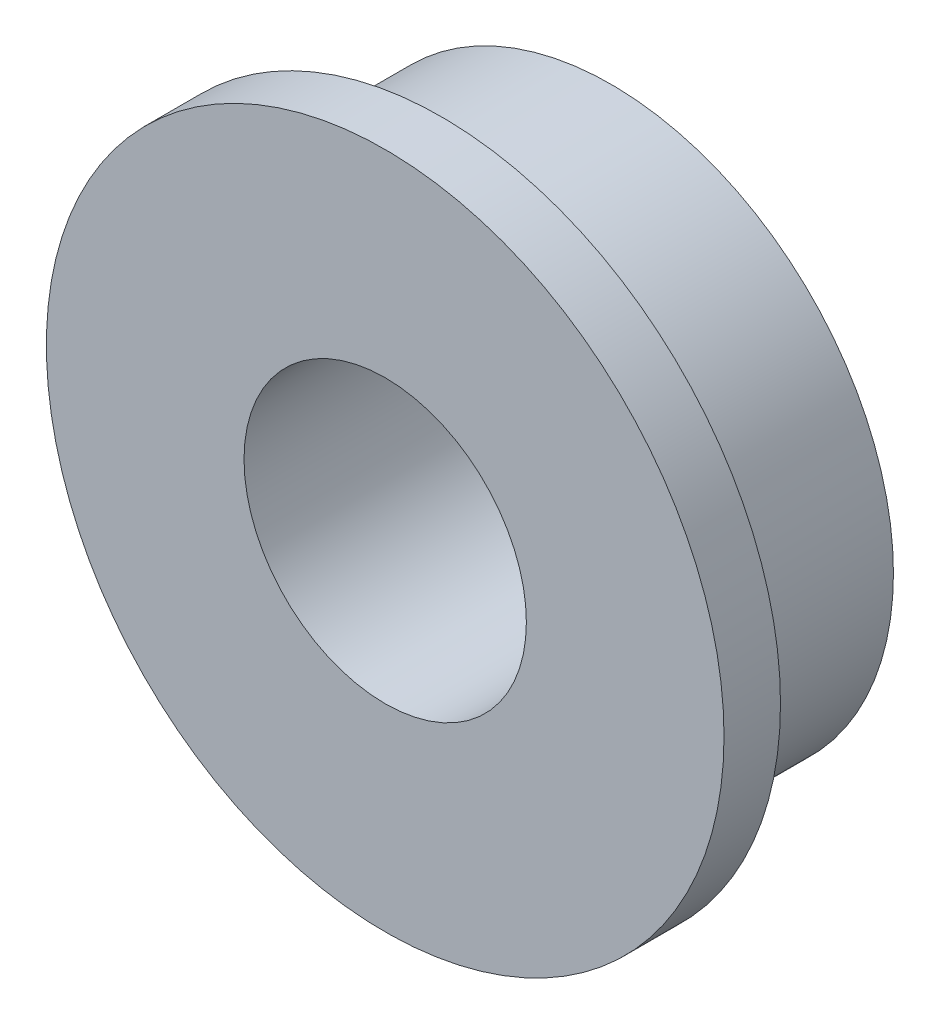
from build123d import *

# Parameters (mm, degrees)
SKETCH1_R           = 5
SKETCH1_R_2         = 2.5
EXTRUDE_4_DEPTH     = 4
BOSS_EXTRUDE2_START = -1
SKETCH2_R           = 6
SKETCH2_R_2         = 2.5
BOSS_EXTRUDE2_DEPTH = 1


with BuildPart() as part:
    # Sketch1 → Extrude 4 (new body)
    with BuildSketch(Plane.XY):
        Circle(SKETCH1_R)
        Circle(SKETCH1_R_2, mode=Mode.SUBTRACT)
    extrude(amount=EXTRUDE_4_DEPTH)

    # Sketch2 → Boss-Extrude2 (add)
    with BuildSketch(Plane.XY.offset(4).offset(BOSS_EXTRUDE2_START)):
        Circle(SKETCH2_R)
        Circle(SKETCH2_R_2, mode=Mode.SUBTRACT)
    extrude(amount=BOSS_EXTRUDE2_DEPTH)


solid = part.part
